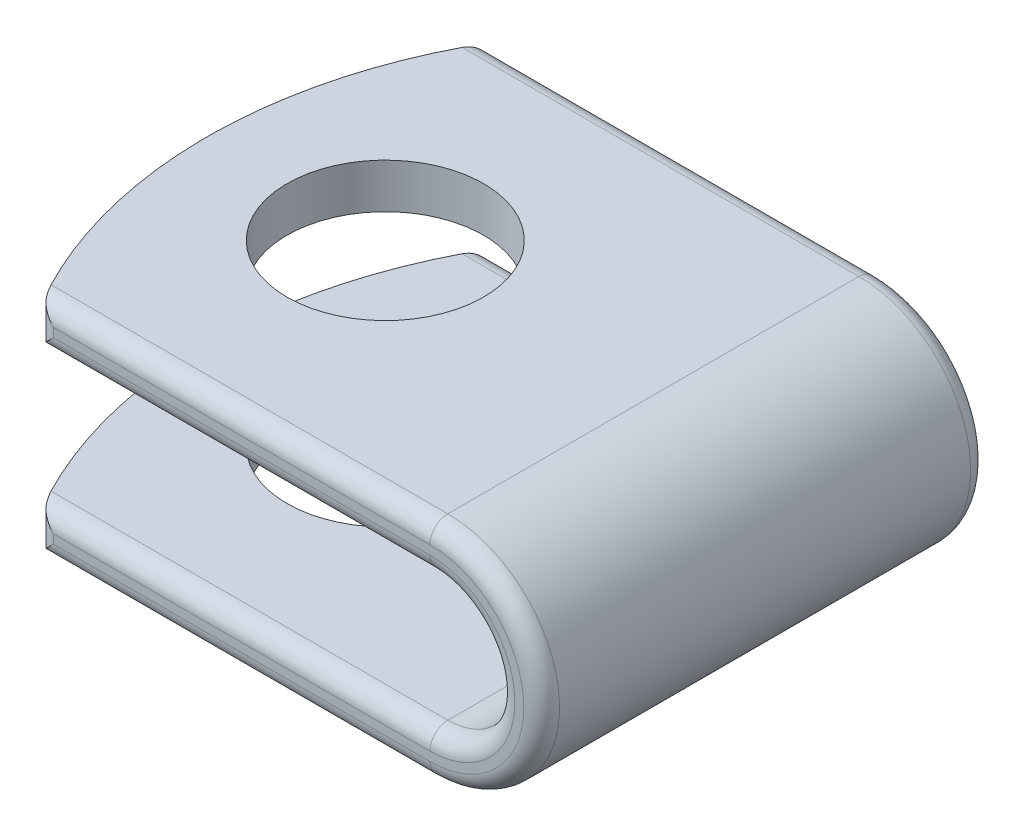
from build123d import *

# Parameters (mm, degrees)
SALIENTE_EXTRUIR1_DEPTH      = 2.5
SALIENTE_EXTRUIR1_DEPTH_BACK = 2.5
CROQUIS2_R                   = 1.1
CORTAR_EXTRUIR1_DEPTH        = 7.123724357
REDONDEO1_R                  = 0.2
REDONDEO2_R                  = 0.2


with BuildPart() as part:
    # Croquis1 → Saliente-Extruir1 (new, two sides: drawn at the far end of the back side and taken through both)
    with BuildSketch(Plane.XY.offset(-SALIENTE_EXTRUIR1_DEPTH_BACK)):
        with BuildLine():
            Line((-5, 1.25), (0, 1.25))
            ThreePointArc((0, 1.25), (1.25, 0), (0, -1.25))
            Line((0, -1.25), (-5, -1.25))
            Line((-5, -1.25), (-5, -0.75))
            Line((-5, -0.75), (0, -0.75))
            ThreePointArc((0, -0.75), (0.75, 0), (0, 0.75))
            Line((0, 0.75), (-5, 0.75))
            Line((-5, 0.75), (-5, 1.25))
        make_face()
    extrude(amount=SALIENTE_EXTRUIR1_DEPTH + SALIENTE_EXTRUIR1_DEPTH_BACK)

    # Croquis2 → Cortar-Extruir1 (cut, through all)
    with BuildSketch(Plane(origin=(0, 1.25, 0), x_dir=(1, 0, 0), z_dir=(0, 1, 0))):
        with BuildLine():
            Line((-5, 2.5), (-5, 0.075509846))
            ThreePointArc((-5, 0.075509846), (-4.820313987, 1.330516743), (-4.330785349, 2.5))
            Line((-4.330785349, 2.5), (-5, 2.5))
        make_face()
        with BuildLine():
            ThreePointArc((-4.330785349, -2.5), (-4.820313987, -1.330516743), (-5, -0.075509846))
            Line((-5, -0.075509846), (-5, -2.5))
            Line((-5, -2.5), (-4.330785349, -2.5))
        make_face()
        with Locations((-3, 0)):
            Circle(CROQUIS2_R)
    extrude(amount=-CORTAR_EXTRUIR1_DEPTH, mode=Mode.SUBTRACT)

    # Redondeo1
    redondeo1_edges = [part.edges().sort_by_distance(p)[0] for p in [
        (-2.165392674, -0.75, 2.5),
        (0.75, 0, 2.5),
        (-2.165392674, 0.75, 2.5),
        (-4.330785349, 1, 2.5),
        (-2.165392674, 1.25, 2.5),
        (1.25, 0, 2.5),
        (-2.165392674, -1.25, 2.5),
        (-4.330785349, -1, 2.5),
    ]]
    fillet(redondeo1_edges, radius=REDONDEO1_R)

    # Redondeo2
    redondeo2_edges = [part.edges().sort_by_distance(p)[0] for p in [
        (-2.165392674, 0.75, -2.5),
        (0.75, 0, -2.5),
        (-2.165392674, -0.75, -2.5),
        (-4.330785349, -1, -2.5),
        (-2.165392674, -1.25, -2.5),
        (1.25, 0, -2.5),
        (-2.165392674, 1.25, -2.5),
        (-4.330785349, 1, -2.5),
    ]]
    fillet(redondeo2_edges, radius=REDONDEO2_R)


solid = part.part
